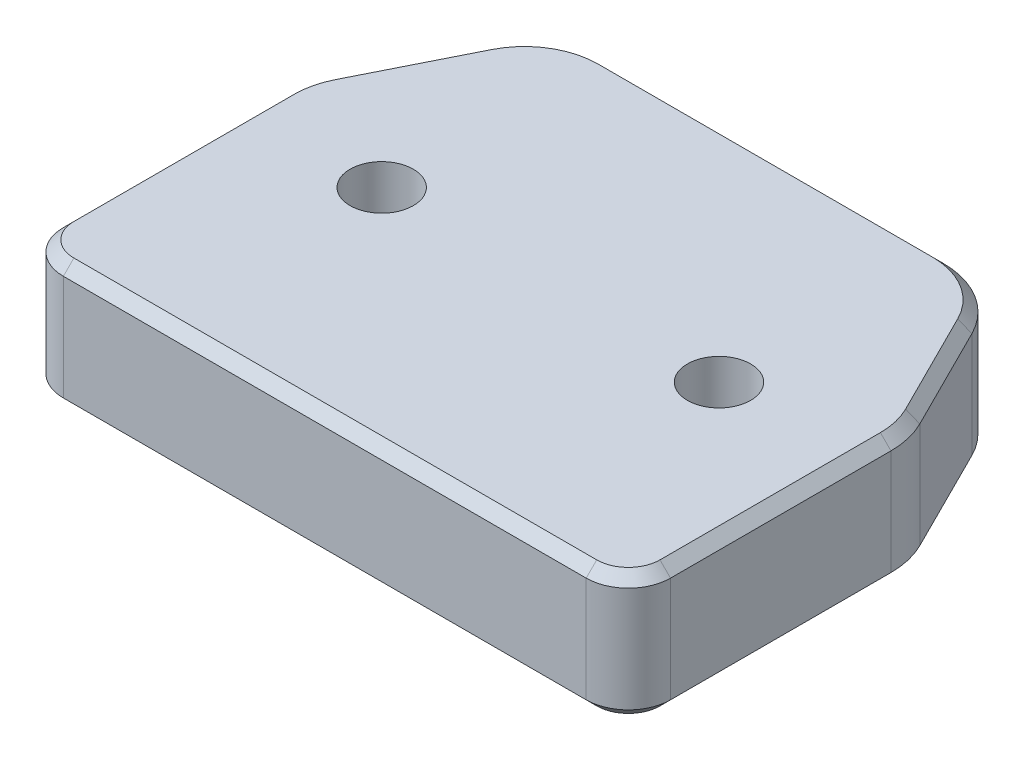
from build123d import *

# Parameters (mm, degrees)
BOSS_EXTRUDE1_DEPTH = 6
FILLET1_R           = 4
FILLET2_R           = 2
SKETCH2_R           = 1.5
CUT_EXTRUDE1_DEPTH  = 6
CHAMFER1_SIZE       = 0.5


with BuildPart() as part:
    # Sketch1 → Boss-Extrude1 (new body)
    with BuildSketch(Plane(origin=(0, 0, 0), x_dir=(1, 0, 0), z_dir=(0, 1, 0))):
        Polygon((-10.4, 10.7), (-14.4, 2.7), (-14.4, -10.7), (14.4, -10.7), (14.4, 2.7), (10.4, 10.7), align=None)
    extrude(amount=BOSS_EXTRUDE1_DEPTH)

    # Fillet1
    fillet1_edges = [part.edges().sort_by_distance(p)[0] for p in [
        (14.4, 3, -2.7),
        (-14.4, 3, -2.7),
        (-10.4, 3, -10.7),
        (10.4, 3, -10.7),
    ]]
    fillet(fillet1_edges, radius=FILLET1_R)

    # Fillet2
    fillet2_edges = [part.edges().sort_by_distance(p)[0] for p in [
        (14.4, 3, 10.7),
        (-14.4, 3, 10.7),
    ]]
    fillet(fillet2_edges, radius=FILLET2_R)

    # Sketch2 → Cut-Extrude1 (cut)
    with BuildSketch(Plane.XZ):
        with Locations(Location((-8, 0, 0), (0, 0, 270))):
            Circle(SKETCH2_R)
        with Locations(Location((8, 0, 0), (0, 0, 270))):
            Circle(SKETCH2_R)
    extrude(amount=-CUT_EXTRUDE1_DEPTH, mode=Mode.SUBTRACT)

    # Chamfer1
    chamfer1_edges = [part.edges().sort_by_distance(p)[0] for p in [
        (12.741640786, 0, -6.016718427),
        (-12.741640786, 0, -6.016718427),
        (0, 0, -10.7),
        (10.030788493, 0, -10.102603233),
        (-10.030788493, 0, -10.102603233),
        (14.292995958, 0, -2.674739772),
        (-14.292995958, 0, -2.674739772),
        (-12.741640786, 6, -6.016718427),
        (12.741640786, 6, -6.016718427),
        (0, 6, -10.7),
        (10.030788493, 6, -10.102603233),
        (-10.030788493, 6, -10.102603233),
        (14.292995958, 6, -2.674739772),
        (-14.292995958, 6, -2.674739772),
        (14.4, 0, 3.472135955),
        (14.4, 6, 3.472135955),
        (-14.4, 0, 3.472135955),
        (0, 0, 10.7),
        (-13.814213562, 0, 10.114213562),
        (13.814213562, 0, 10.114213562),
        (0, 6, 10.7),
        (-14.4, 6, 3.472135955),
        (-13.814213562, 6, 10.114213562),
        (13.814213562, 6, 10.114213562),
    ]]
    chamfer(chamfer1_edges, length=CHAMFER1_SIZE)


solid = part.part
